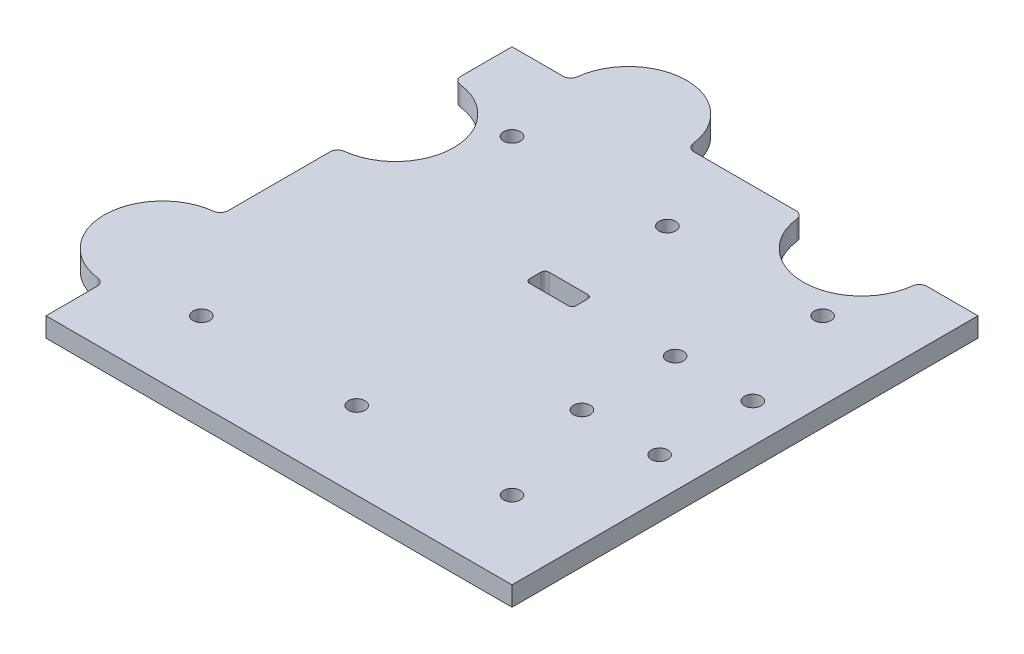
from build123d import *

# Parameters (mm, degrees)
SKETCH1_R           = 2.15
SKETCH1_W           = 12
SKETCH1_H           = 5
BOSS_EXTRUDE1_DEPTH = 5
FILLET1_R           = 2
FILLET2_R           = 1


with BuildPart() as part:
    # Sketch1 → Boss-Extrude1 (new body)
    with BuildSketch(Plane(origin=(0, 0, 0), x_dir=(1, 0, 0), z_dir=(0, 1, 0))):
        with BuildLine():
            Line((60, -60), (-60, -60))
            Line((-60, -60), (-60, -45))
            ThreePointArc((-60, -45), (-75, -30), (-60, -15))
            Line((-60, -15), (-60, 15))
            ThreePointArc((-60, 15), (-45, 30), (-60, 45))
            Line((-60, 45), (-60, 60))
            Line((-60, 60), (-45, 60))
            ThreePointArc((-45, 60), (-30, 75), (-15, 60))
            Line((-15, 60), (15, 60))
            ThreePointArc((15, 60), (30, 45), (45, 60))
            Line((45, 60), (60, 60))
            Line((60, 60), (60, -60))
        make_face()
        with Locations((-40, 40)):
            Circle(SKETCH1_R, mode=Mode.SUBTRACT)
        with Locations((40, 40)):
            Circle(SKETCH1_R, mode=Mode.SUBTRACT)
        with Locations((40, -40)):
            Circle(SKETCH1_R, mode=Mode.SUBTRACT)
        with Locations((-40, -40)):
            Circle(SKETCH1_R, mode=Mode.SUBTRACT)
        with Locations((30, 12)):
            Circle(SKETCH1_R, mode=Mode.SUBTRACT)
        with Locations((50, 12)):
            Circle(SKETCH1_R, mode=Mode.SUBTRACT)
        with Locations((30, -12)):
            Circle(SKETCH1_R, mode=Mode.SUBTRACT)
        with Locations((50, -12)):
            Circle(SKETCH1_R, mode=Mode.SUBTRACT)
        with Locations((0, 40)):
            Circle(SKETCH1_R, mode=Mode.SUBTRACT)
        with Locations((0, -40)):
            Circle(SKETCH1_R, mode=Mode.SUBTRACT)
        with Locations((0, 12)):
            Rectangle(SKETCH1_W, SKETCH1_H, mode=Mode.SUBTRACT)
    extrude(amount=BOSS_EXTRUDE1_DEPTH)

    # Fillet1
    fillet1_edges = [part.edges().sort_by_distance(p)[0] for p in [
        (-60, 2.5, 45),
        (-60, 2.5, 15),
        (45, 2.5, -60),
        (15, 2.5, -60),
        (-15, 2.5, -60),
        (-45, 2.5, -60),
        (-60, 2.5, -45),
        (-60, 2.5, -15),
    ]]
    fillet(fillet1_edges, radius=FILLET1_R)

    # Fillet2
    fillet2_edges = [part.edges().sort_by_distance(p)[0] for p in [
        (6, 2.5, -9.5),
        (6, 2.5, -14.5),
        (-6, 2.5, -9.5),
        (-6, 2.5, -14.5),
    ]]
    fillet(fillet2_edges, radius=FILLET2_R)


solid = part.part
